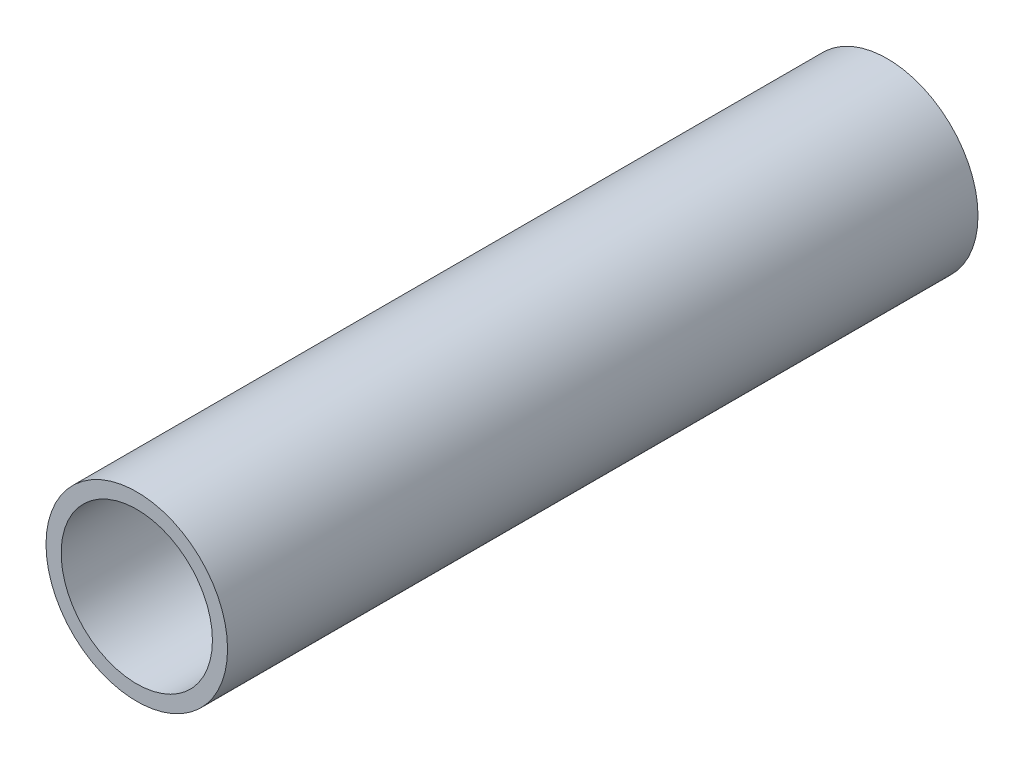
from build123d import *

# Parameters (mm, degrees)
SKETCH1_R           = 15
SKETCH1_R_2         = 12.5
BOSS_EXTRUDE1_DEPTH = 124


with BuildPart() as part:
    # Sketch1 → Boss-Extrude1 (new body)
    with BuildSketch(Plane.XY):
        Circle(SKETCH1_R)
        Circle(SKETCH1_R_2, mode=Mode.SUBTRACT)
    extrude(amount=BOSS_EXTRUDE1_DEPTH)


solid = part.part
